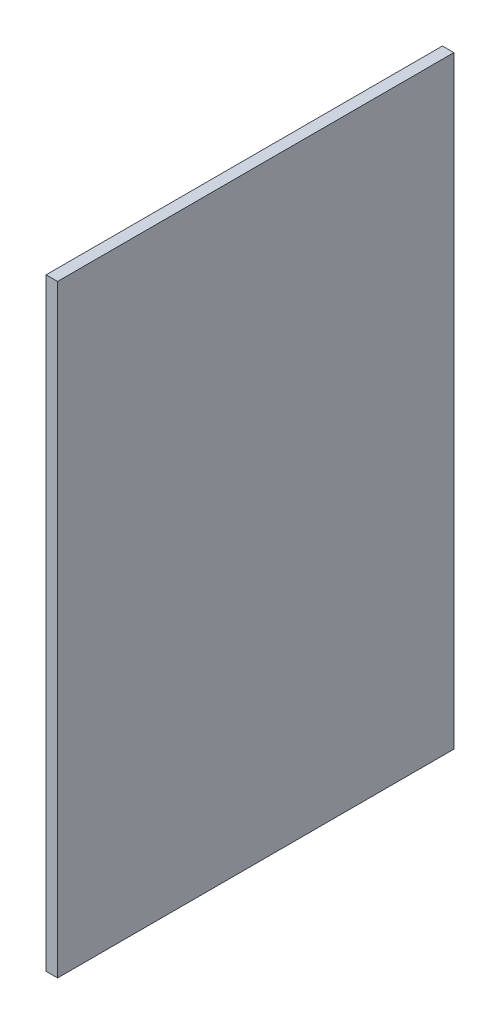
from build123d import *

# Parameters (mm, degrees)
SKETCH1_W           = 103.610699172
SKETCH1_H           = 157.719537065
BOSS_EXTRUDE1_DEPTH = 3


with BuildPart() as part:
    # Sketch1 → Boss-Extrude1 (new body)
    with BuildSketch(Plane(origin=(0, 0, 0), x_dir=(0, 0, -1), z_dir=(1, 0, 0))):
        with Locations((51.805349586, 78.859768532)):
            Rectangle(SKETCH1_W, SKETCH1_H)
    extrude(amount=BOSS_EXTRUDE1_DEPTH)


solid = part.part
